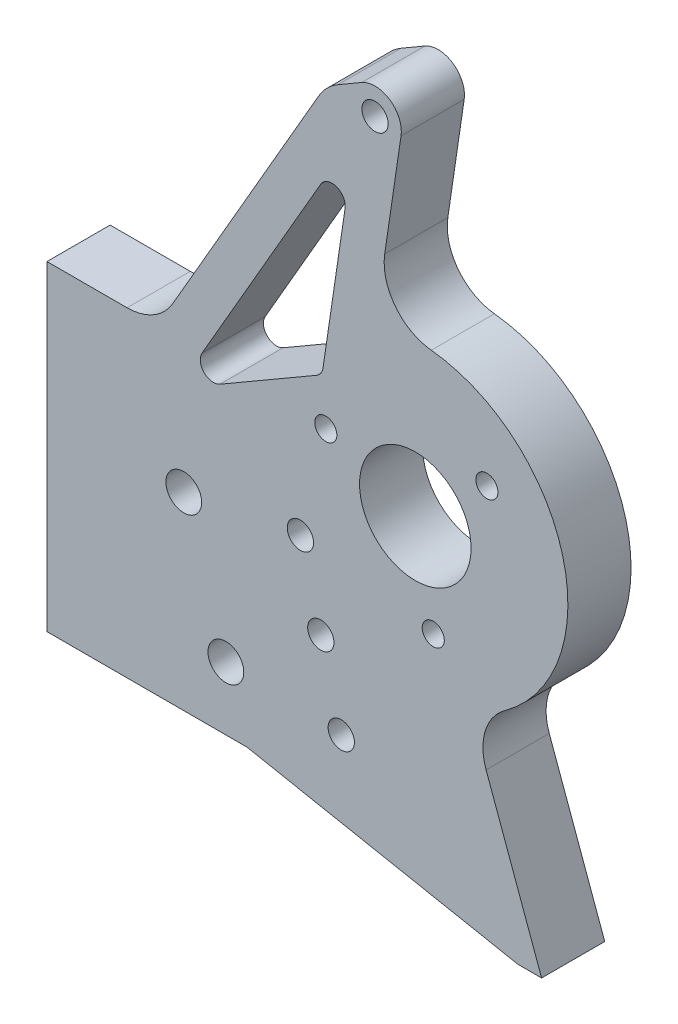
from build123d import *

# Parameters (mm, degrees)
ESBO_O1_R                                   = 10.6
RESSALTO_EXTRUS_O1_DEPTH                    = 12
FILETE1_R                                   = 10
CORTE_EXTRUS_O1_DEPTH                       = 161.30276936
FILETE3_R                                   = 2.5
CORTE_EXTRUS_O2_DEPTH                       = 161.30276936
BROCA_DE_ROSQUEAR_PARA_TARRAXA_DE_M81_D     = 6.8
BROCA_DE_ROSQUEAR_PARA_TARRAXA_DE_M81_DEPTH = 15
BROCA_DE_ROSQUEAR_PARA_TARRAXA_DE_M81_TIP   = 2.042926105
FILETE6_R                                   = 10
FILETE7_R                                   = 5
BROCA_DE_ROSQUEAR_PARA_TARRAXA_DE_M61_D     = 5
BROCA_DE_ROSQUEAR_PARA_TARRAXA_DE_M82_D     = 6.8
BROCA_DE_ROSQUEAR_PARA_TARRAXA_DE_M51_D     = 4.2
BROCA_DE_ROSQUEAR_PARA_TARRAXA_DE_M62_D     = 5


with BuildPart() as part:
    # Esboço1 → Ressalto-extrusão1 (new body)
    with BuildSketch(Plane.XY):
        with BuildLine():
            Line((0, 0), (36, 0))
            Line((36, 0), (36, -10))
            Line((36, -10), (94, -10))
            Line((94, -10), (80.53931892, 26.982917317))
            ThreePointArc((80.53931892, 26.982917317), (97.53650317, 63.096207626), (62.372346743, 81.978901083))
            Line((62.372346743, 81.978901083), (68.8, 125.506883733))
            Line((68.8, 125.506883733), (53, 116.345625842))
            Line((53, 116.345625842), (21, 60.92))
            Line((21, 60.92), (0, 60.92))
            Line((0, 60.92), (0, 0))
        make_face()
        with Locations((70, 54)):
            Circle(ESBO_O1_R, mode=Mode.SUBTRACT)
    extrude(amount=RESSALTO_EXTRUS_O1_DEPTH)

    # Filete1
    filete1_edges = [part.edges().sort_by_distance(p)[0] for p in [
        (21, 60.92, 6),
        (53, 116.345625842, 6),
        (62.372346743, 81.978901083, 6),
    ]]
    fillet(filete1_edges, radius=FILETE1_R)

    # Esboço2 → Corte-extrusão1 (cut, through all)
    with BuildSketch(Plane.XY.offset(12)):
        Polygon((24.783390445, 52.473024476), (58.570061959, 110.993256157), (52.283390445, 68.42), align=None)
    extrude(amount=-CORTE_EXTRUS_O1_DEPTH, mode=Mode.SUBTRACT)

    # Filete3
    filete3_edges = [part.edges().sort_by_distance(p)[0] for p in [
        (52.283390445, 68.42, 6),
        (24.783390445, 52.473024476, 6),
        (58.570061959, 110.993256157, 6),
    ]]
    fillet(filete3_edges, radius=FILETE3_R)

    # Esboço8 → Corte-extrusão2 (cut, through all)
    with BuildSketch(Plane.XY.offset(12)):
        Polygon((89.5, -10), (38, 0), (36, 0), (36, -10), align=None)
    extrude(amount=-CORTE_EXTRUS_O2_DEPTH, mode=Mode.SUBTRACT)

    # Broca de rosquear para tarraxa de M81
    with Locations(Plane.ZY):
        with Locations((6, 50.92), (6, 30.46), (6, 10)):
            Hole(BROCA_DE_ROSQUEAR_PARA_TARRAXA_DE_M81_D / 2, depth=BROCA_DE_ROSQUEAR_PARA_TARRAXA_DE_M81_DEPTH)
            with Locations((0, 0, -(BROCA_DE_ROSQUEAR_PARA_TARRAXA_DE_M81_DEPTH + BROCA_DE_ROSQUEAR_PARA_TARRAXA_DE_M81_TIP / 2))):  # 118° drill point
                Cone(0, BROCA_DE_ROSQUEAR_PARA_TARRAXA_DE_M81_D / 2, BROCA_DE_ROSQUEAR_PARA_TARRAXA_DE_M81_TIP, mode=Mode.SUBTRACT)

    # Filete6
    filete6_edges = [part.edges().sort_by_distance(p)[0] for p in [
        (80.53931892, 26.982917317, 6),
    ]]
    fillet(filete6_edges, radius=FILETE6_R)

    # Filete7
    filete7_edges = [part.edges().sort_by_distance(p)[0] for p in [
        (68.8, 125.506883733, 6),
    ]]
    fillet(filete7_edges, radius=FILETE7_R)

    # Broca de rosquear para tarraxa de M61 (through all)
    with Locations(Plane.XY.offset(12)):
        with Locations((48.161384096, 39.952181527), (52.043669773, 25.463294133), (55.925955449, 10.974406739)):
            Hole(BROCA_DE_ROSQUEAR_PARA_TARRAXA_DE_M61_D / 2)

    # Broca de rosquear para tarraxa de M82 (through all)
    with Locations(Plane.XY.offset(12)):
        with Locations((26, 35.952181527), (34, 12)):
            Hole(BROCA_DE_ROSQUEAR_PARA_TARRAXA_DE_M82_D / 2)

    # Broca de rosquear para tarraxa de M51 (through all)
    with Locations(Plane.XY.offset(12)):
        with Locations((83.600921147, 65.790459871), (73.410377197, 36.326026837), (52.988701656, 59.883513293)):
            Hole(BROCA_DE_ROSQUEAR_PARA_TARRAXA_DE_M51_D / 2)

    # Broca de rosquear para tarraxa de M62 (through all)
    with Locations(Plane.XY.offset(12)):
        with Locations((62.339118507, 115.980990674)):
            Hole(BROCA_DE_ROSQUEAR_PARA_TARRAXA_DE_M62_D / 2)


solid = part.part
